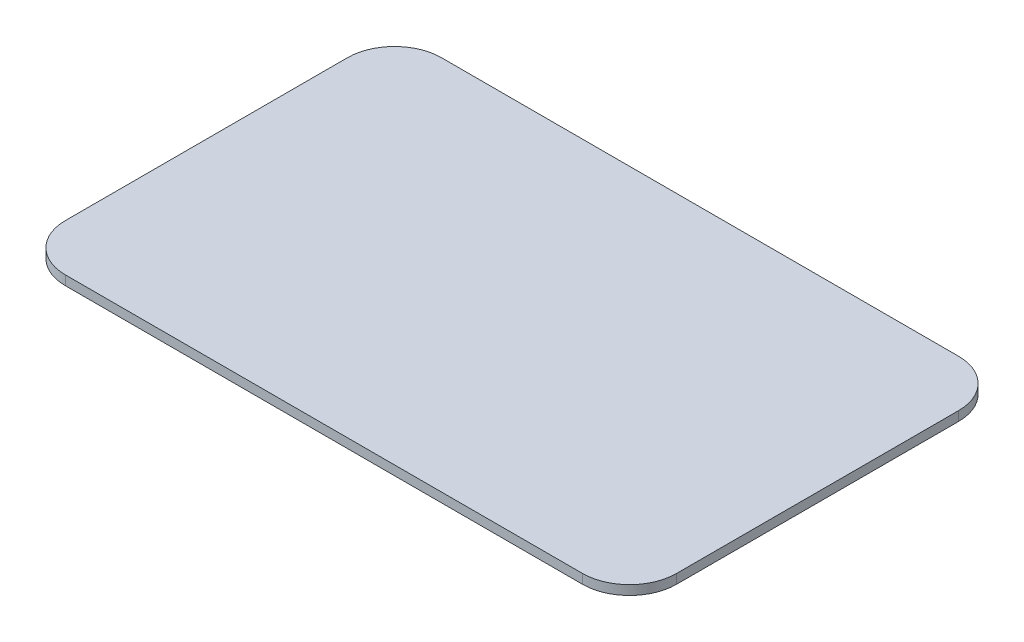
from build123d import *

# Parameters (mm, degrees)
BOSS_EXTRUDE1_DEPTH = 2


with BuildPart() as part:
    # Sketch1 → Boss-Extrude1 (new body)
    with BuildSketch(Plane(origin=(0, 0, 0), x_dir=(1, 0, 0), z_dir=(0, 1, 0))):
        with BuildLine():
            Line((-54.506589101, -40.328940599), (55.493410899, -40.328940599))
            ThreePointArc((55.493410899, -40.328940599), (62.564478711, -37.400008411), (65.493410899, -30.328940599))
            Line((65.493410899, -30.328940599), (65.493410899, 29.671059401))
            ThreePointArc((65.493410899, 29.671059401), (62.564478711, 36.742127213), (55.493410899, 39.671059401))
            Line((55.493410899, 39.671059401), (-54.506589101, 39.671059401))
            ThreePointArc((-54.506589101, 39.671059401), (-61.577656913, 36.742127213), (-64.506589101, 29.671059401))
            Line((-64.506589101, 29.671059401), (-64.506589101, -30.328940599))
            ThreePointArc((-64.506589101, -30.328940599), (-61.577656913, -37.400008411), (-54.506589101, -40.328940599))
        make_face()
    extrude(amount=BOSS_EXTRUDE1_DEPTH)


solid = part.part
